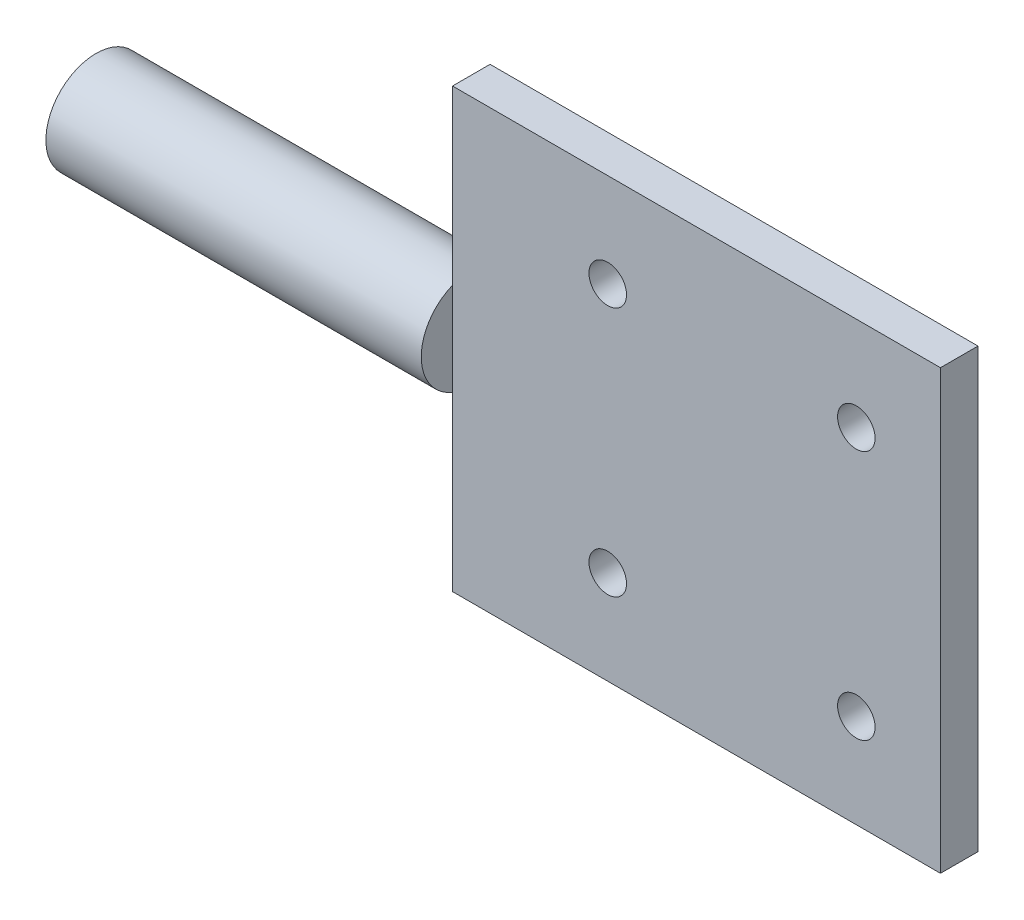
from build123d import *

# Parameters (mm, degrees)
SKETCH_1_W           = 34
SKETCH_1_H           = 35
EXTRUDE_1_DEPTH      = 3
SKETCH_2_W           = 5
SKETCH_2_H           = 5
EXTRUDE_2_DEPTH      = 3
SKETCH_7_R           = 1.5
CUT_EXTRUDE_7_DEPTH  = 3
SKETCH_14_R          = 4
EXTRUDE_6_DEPTH      = 25
EXTRUDE_START        = 5
SKETCH_16_R          = 4
EXTRUDE_7_DEPTH      = 5
CUT_EXTRUDE_START    = -5
CUT_EXTRUDE_9_DEPTH  = 5
EXTRUDE_8_DEPTH      = 5
SKETCH_19_W          = 5
SKETCH_19_H          = 2.5
CUT_EXTRUDE_10_DEPTH = 59.857879676
SKETCH_20_R          = 4
EXTRUDE_9_DEPTH      = 29.5
SKETCH_21_W          = 26.980293682
SKETCH_21_H          = 10.390157326
CUT_EXTRUDE_11_DEPTH = 85.305990297


with BuildPart() as part:
    # 草图1 → 凸台-拉伸1 (new body)
    with BuildSketch(Plane.XY):
        Rectangle(SKETCH_1_W, SKETCH_1_H)
    extrude(amount=EXTRUDE_1_DEPTH)

    # 草图2 → 凸台-拉伸2 (add)
    with BuildSketch(Plane.XY.offset(3)):
        with Locations((-19.5, 2.5)):
            Rectangle(SKETCH_2_W, SKETCH_2_H)
        with Locations((-19.5, -2.5)):
            Rectangle(SKETCH_2_W, SKETCH_2_H)
    extrude(amount=-EXTRUDE_2_DEPTH)

    # 草图7 → 切除-拉伸7 (cut)
    with BuildSketch(Plane.XY.offset(3)):
        with Locations((10.27515824, 10)):
            Circle(SKETCH_7_R)
        with Locations((10.27515824, -10)):
            Circle(SKETCH_7_R)
        with Locations((-9.593631375, 10)):
            Circle(SKETCH_7_R)
        with Locations((-9.593631375, -10)):
            Circle(SKETCH_7_R)
    extrude(amount=-CUT_EXTRUDE_7_DEPTH, mode=Mode.SUBTRACT)

    # 草图14 → 凸台-拉伸6 (add)
    with BuildSketch(Plane.ZY.offset(22)):
        with Locations(Location((1.5, 0, 0), (0, 0, 112.024312837))):
            Circle(SKETCH_14_R)
    extrude(amount=EXTRUDE_6_DEPTH)

    # 草图16 → 凸台-拉伸7 (add)
    with BuildSketch(Plane(origin=(-22, 0, 0), x_dir=(0, 0, -1), z_dir=(1, 0, 0)).offset(EXTRUDE_START)):
        with Locations(Location((-1.5, 0, 0), (0, 0, 67.975687163))):
            Circle(SKETCH_16_R)
    extrude(amount=-EXTRUDE_7_DEPTH)

    # 草图17 → 切除-拉伸9 (cut)
    with BuildSketch(Plane.ZY.offset(22).offset(CUT_EXTRUDE_START)):
        with BuildLine():
            Line((3, 3.708099244), (3, 5))
            Line((3, 5), (0, 5))
            Line((0, 5), (0, 3.708099244))
            ThreePointArc((0, 3.708099244), (1.5, 4), (3, 3.708099244))
        make_face()
        with BuildLine():
            Line((0, -3.708099244), (0, -5))
            Line((0, -5), (3, -5))
            Line((3, -5), (3, -3.708099244))
            ThreePointArc((3, -3.708099244), (1.5, -4), (0, -3.708099244))
        make_face()
    extrude(amount=CUT_EXTRUDE_9_DEPTH, mode=Mode.SUBTRACT)

    # 草图18 → 凸台-拉伸8 (add)
    with BuildSketch(Plane.ZY.offset(17)):
        with BuildLine():
            Line((3, -17.5), (3, -3.708099244))
            ThreePointArc((3, -3.708099244), (1.5, -4), (0, -3.708099244))
            Line((0, -3.708099244), (0, -17.5))
            Line((0, -17.5), (3, -17.5))
        make_face()
        with BuildLine():
            Line((0, 17.5), (0, 3.708099244))
            ThreePointArc((0, 3.708099244), (1.5, 4), (3, 3.708099244))
            Line((3, 3.708099244), (3, 17.5))
            Line((3, 17.5), (0, 17.5))
        make_face()
    extrude(amount=EXTRUDE_8_DEPTH)

    # 草图19 → 切除-拉伸10 (cut, through all)
    with BuildSketch(Plane.XZ.offset(17.5)):
        with Locations((-19.5, 4.25)):
            Rectangle(SKETCH_19_W, SKETCH_19_H)
        with Locations((-19.5, -1.25)):
            Rectangle(SKETCH_19_W, SKETCH_19_H)
    extrude(amount=-CUT_EXTRUDE_10_DEPTH, mode=Mode.SUBTRACT)

    # 草图20 → 凸台-拉伸9 (add)
    with BuildSketch(Plane.ZY.offset(47)):
        with Locations(Location((1.5, 0, 0), (0, 0, 112.024312837))):
            Circle(SKETCH_20_R)
    extrude(amount=EXTRUDE_9_DEPTH)

    # 草图21 → 切除-拉伸11 (cut, through all)
    with BuildSketch(Plane.XZ.offset(17.5)):
        with Locations((-65.490146841, 2.695078663)):
            Rectangle(SKETCH_21_W, SKETCH_21_H)
    extrude(amount=-CUT_EXTRUDE_11_DEPTH, mode=Mode.SUBTRACT)


solid = part.part
